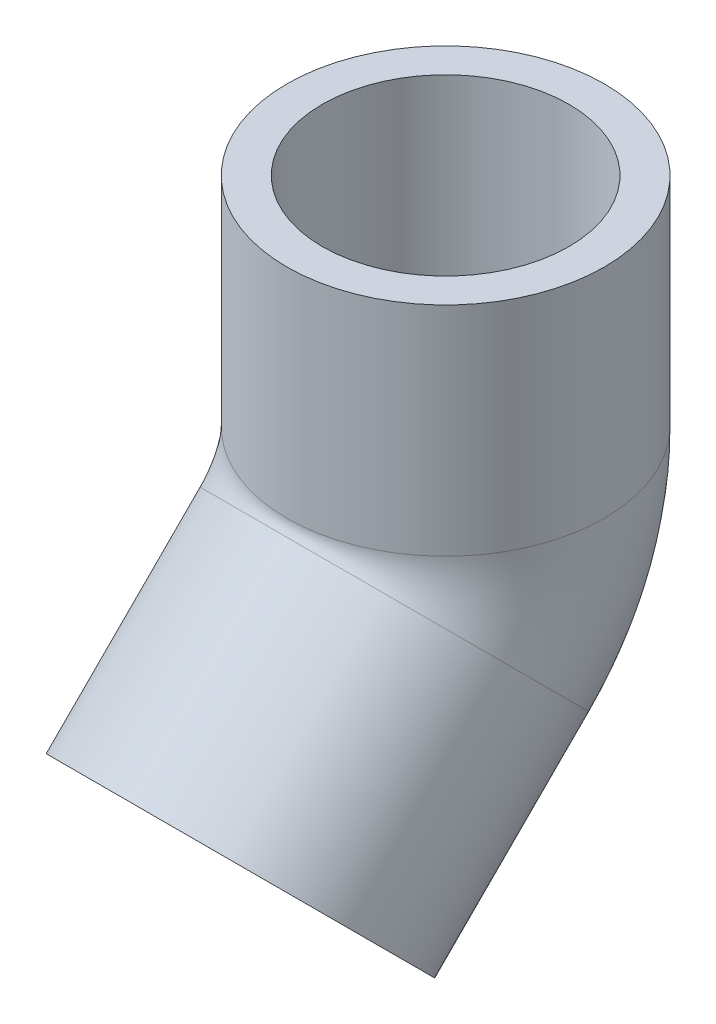
from build123d import *

# Parameters (mm, degrees)
SKETCH3_R          = 13.890625
SKETCH3_R_2        = 7.8994
SKETCH4_R          = 10.795
CUT_EXTRUDE1_DEPTH = 19.05
SKETCH5_R          = 10.795
CUT_EXTRUDE2_DEPTH = 19.05


with BuildPart() as part:
    # Sweep1: sweep along a path in Sketch2
    with BuildLine(Plane(origin=(0, 0, 0), x_dir=(0, 0, -1), z_dir=(1, 0, 0))) as sweep1_path:
        Line((-17.960512242, -17.960512242), (-4.490128061, -4.490128061))
        ThreePointArc((-4.490128061, -4.490128061), (-1.166946263, 0.483364969), (0, 6.35))
        Line((0, 6.35), (0, 25.4))
    # Sketch3 → Sweep1 (sweep)
    with BuildSketch(Plane(origin=(0, 25.4, 0), x_dir=(1, 0, 0), z_dir=(0, 1, 0))):
        Circle(SKETCH3_R)
        Circle(SKETCH3_R_2, mode=Mode.SUBTRACT)
    sweep(path=sweep1_path.line)

    # Sketch4 → Cut-Extrude1 (cut)
    with BuildSketch(Plane(origin=(0, 25.4, 0), x_dir=(1, 0, 0), z_dir=(0, 1, 0))):
        with Locations(Location((0, 0, 0), (0, 0, 270))):
            Circle(SKETCH4_R)
    extrude(amount=-CUT_EXTRUDE1_DEPTH, mode=Mode.SUBTRACT)

    # Sketch5 → Cut-Extrude2 (cut)
    with BuildSketch(Plane(origin=(0, -17.960512242, 17.960512242), x_dir=(1, 0, 0), z_dir=(0, -0.7071067811865559, 0.7071067811865392))):
        with Locations(Location((0, 0, 0), (0, 0, 270))):
            Circle(SKETCH5_R)
    extrude(amount=-CUT_EXTRUDE2_DEPTH, mode=Mode.SUBTRACT)


solid = part.part
